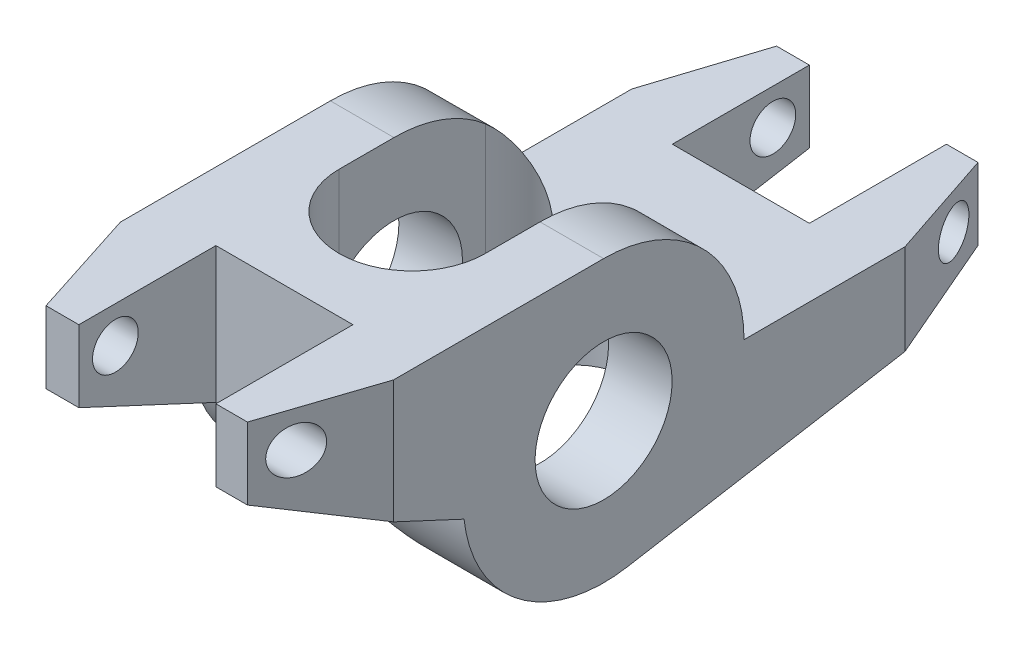
from build123d import *
from OCP.BRepFilletAPI import BRepFilletAPI_MakeChamfer

# Parameters (mm, degrees)
SKETCH1_R           = 4.765
BOSS_EXTRUDE1_DEPTH = 9.5
CHAMFER1_SIZE       = 2.54
CHAMFER1_SIZE2      = 7.62
CHAMFER2_SIZE       = 7.62
CHAMFER2_SIZE2      = 2.45
CUT_EXTRUDE1_DEPTH  = 17.5
SKETCH3_W           = 9.53
SKETCH3_H           = 9.53
CUT_EXTRUDE2_DEPTH  = 17.5
SKETCH4_R           = 1.59
CUT_EXTRUDE3_DEPTH  = 17.5


with BuildPart() as part:
    # Sketch1 → Boss-Extrude1 (new, symmetric)
    with BuildSketch(Plane(origin=(0, 0, 0), x_dir=(0, 0, -1), z_dir=(1, 0, 0))):
        with BuildLine():
            Line((0, 9.765), (-22.225, 9.765))
            Line((-22.225, 9.765), (-22.225, 4.765))
            Line((-22.225, 4.765), (-9.705896356, -1.072753903))
            ThreePointArc((-9.705896356, -1.072753903), (-5.873116096, -7.801392973), (1.653013564, -9.624072483))
            Line((1.653013564, -9.624072483), (28.575, -5))
            Line((28.575, -5), (28.575, 0))
            Line((28.575, 0), (9.765, 0))
            ThreePointArc((9.765, 0), (6.904897718, 6.904897718), (0, 9.765))
        make_face()
        Circle(SKETCH1_R, mode=Mode.SUBTRACT)
    extrude(amount=BOSS_EXTRUDE1_DEPTH, both=True)

    # Chamfer1: one chamfer whose edges measure the first distance from different faces: ONE call of the kernel's chamfer builder (chamfer() names one face for all edges)
    chamfer1_edges_1 = [part.edges().sort_by_distance(p)[0] for p in [
        (9.5, 7.265, 22.225),
    ]]
    chamfer1_side_1 = [part.faces().sort_by_distance(p)[0] for p in [
        (0, 7.265, 22.225),
    ]]
    chamfer1_edges_2 = [part.edges().sort_by_distance(p)[0] for p in [
        (9.5, -2.5, -28.575),
    ]]
    chamfer1_side_2 = [part.faces().sort_by_distance(p)[0] for p in [
        (0, -2.5, -28.575),
    ]]
    chamfer1 = BRepFilletAPI_MakeChamfer(part.part.solid().wrapped)
    for e in chamfer1_edges_1:
        chamfer1.Add(CHAMFER1_SIZE, CHAMFER1_SIZE2, e.wrapped, chamfer1_side_1[0].wrapped)  # the first distance lies on this face
    for e in chamfer1_edges_2:
        chamfer1.Add(CHAMFER1_SIZE, CHAMFER1_SIZE2, e.wrapped, chamfer1_side_2[0].wrapped)  # the first distance lies on this face
    add(Compound.cast(chamfer1.Shape()), mode=Mode.REPLACE)

    # Chamfer2
    chamfer2_edges = [part.edges().sort_by_distance(p)[0] for p in [
        (-9.5, 7.265, 22.225),
        (-9.5, -2.5, -28.575),
    ]]
    chamfer2_side = [part.faces().sort_by_distance(p)[0] for p in [
        (-9.5, 9.220751812, 11.1125),
    ]]
    chamfer(chamfer2_edges, length=CHAMFER2_SIZE, length2=CHAMFER2_SIZE2, reference=chamfer2_side[0])

    # Sketch2 → Cut-Extrude1 (cut, symmetric)
    with BuildSketch(Plane(origin=(0, 0, 0), x_dir=(1, 0, 0), z_dir=(0, 1, 0))):
        with BuildLine():
            Line((5.08, 6.35), (5.08, -3.81))
            ThreePointArc((5.08, -3.81), (0, -8.89), (-5.08, -3.81))
            Line((-5.08, -3.81), (-5.08, 6.35))
            ThreePointArc((-5.08, 6.35), (0, 11.43), (5.08, 6.35))
        make_face()
    extrude(amount=CUT_EXTRUDE1_DEPTH, both=True, mode=Mode.SUBTRACT)

    # Sketch3 → Cut-Extrude2 (cut, symmetric)
    with BuildSketch(Plane(origin=(0, 0, 0), x_dir=(1, 0, 0), z_dir=(0, 1, 0))):
        with Locations((0, 23.81)):
            Rectangle(SKETCH3_W, SKETCH3_H)
        with Locations((0, -17.46)):
            Rectangle(SKETCH3_W, SKETCH3_H)
    extrude(amount=CUT_EXTRUDE2_DEPTH, both=True, mode=Mode.SUBTRACT)

    # Sketch4 → Cut-Extrude3 (cut, symmetric)
    with BuildSketch(Plane(origin=(0, 0, 0), x_dir=(0, 0, -1), z_dir=(1, 0, 0))):
        with Locations((-19.685, 7.225)):
            Circle(SKETCH4_R)
        with Locations((26.035, -2.5)):
            Circle(SKETCH4_R)
    extrude(amount=CUT_EXTRUDE3_DEPTH, both=True, mode=Mode.SUBTRACT)


solid = part.part
